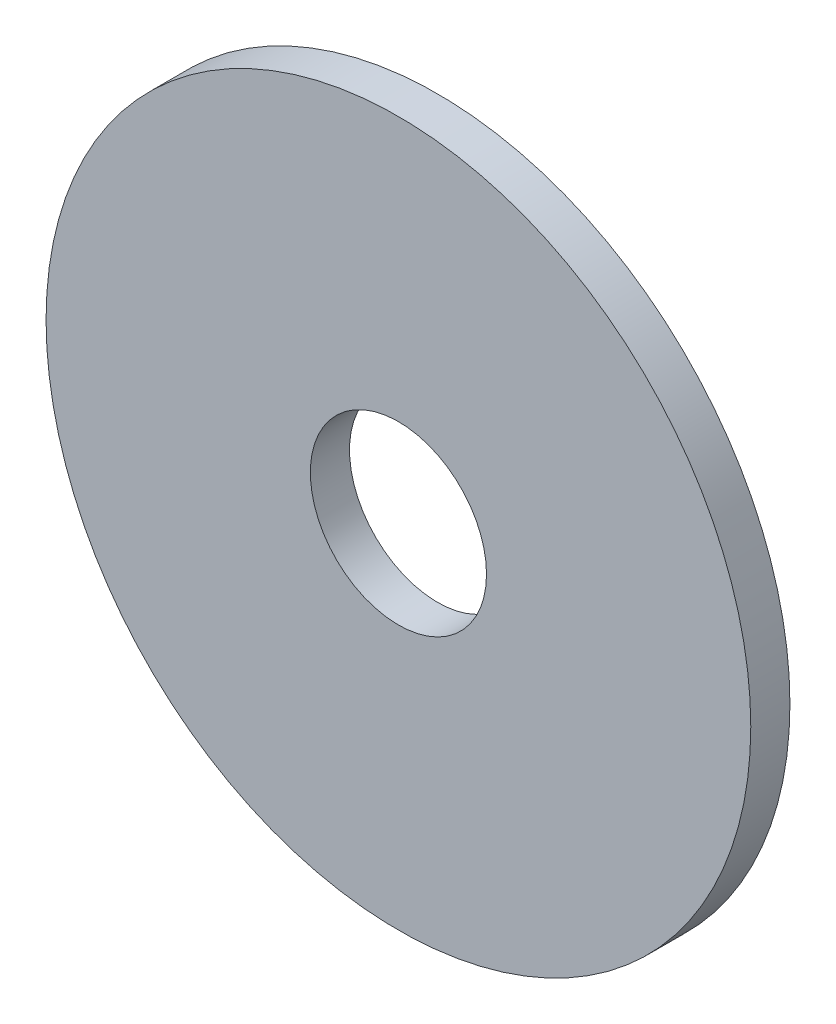
from build123d import *

# Parameters (mm, degrees)
SKETCH1_R           = 9
SKETCH1_R_2         = 2.25
BOSS_EXTRUDE1_DEPTH = 0.5


with BuildPart() as part:
    # Sketch1 → Boss-Extrude1 (new, symmetric)
    with BuildSketch(Plane(origin=(0, 0, 0), x_dir=(0, 1, 0), z_dir=(0, 0, 1))):
        with Locations(Location((0, 0, 0), (0, 0, 270))):
            Circle(SKETCH1_R)
        with Locations(Location((0, 0, 0), (0, 0, 270))):
            Circle(SKETCH1_R_2, mode=Mode.SUBTRACT)
    extrude(amount=BOSS_EXTRUDE1_DEPTH, both=True)


solid = part.part
